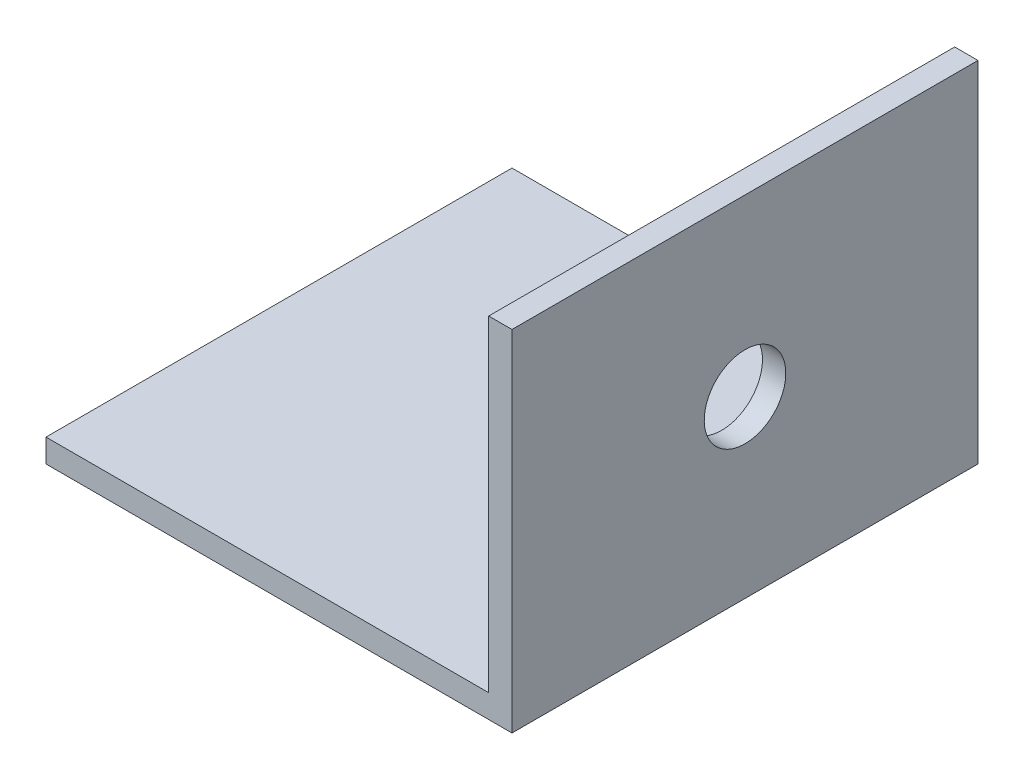
from build123d import *

# Parameters (mm, degrees)
SALIENTE_EXTRUIR1_DEPTH = 40
CROQUIS2_R              = 3.5
CORTAR_EXTRUIR1_DEPTH   = 64.2003722


with BuildPart() as part:
    # Croquis1 → Saliente-Extruir1 (new body)
    with BuildSketch(Plane.XY):
        Polygon((0.551367026, 28.183098592), (0.551367026, -1.816901408), (-39.448632974, -1.816901408), (-39.448632974, 0.183098592), (-1.448632974, 0.183098592), (-1.448632974, 28.183098592), align=None)
    extrude(amount=SALIENTE_EXTRUIR1_DEPTH)

    # Croquis2 → Cortar-Extruir1 (cut, through all)
    with BuildSketch(Plane(origin=(0.551367026, 0, 0), x_dir=(0, 0, -1), z_dir=(1, 0, 0))):
        with Locations(Location((-20, 13.183098592, 0), (0, 0, 90))):
            Circle(CROQUIS2_R)
    extrude(amount=-CORTAR_EXTRUIR1_DEPTH, mode=Mode.SUBTRACT)


solid = part.part
